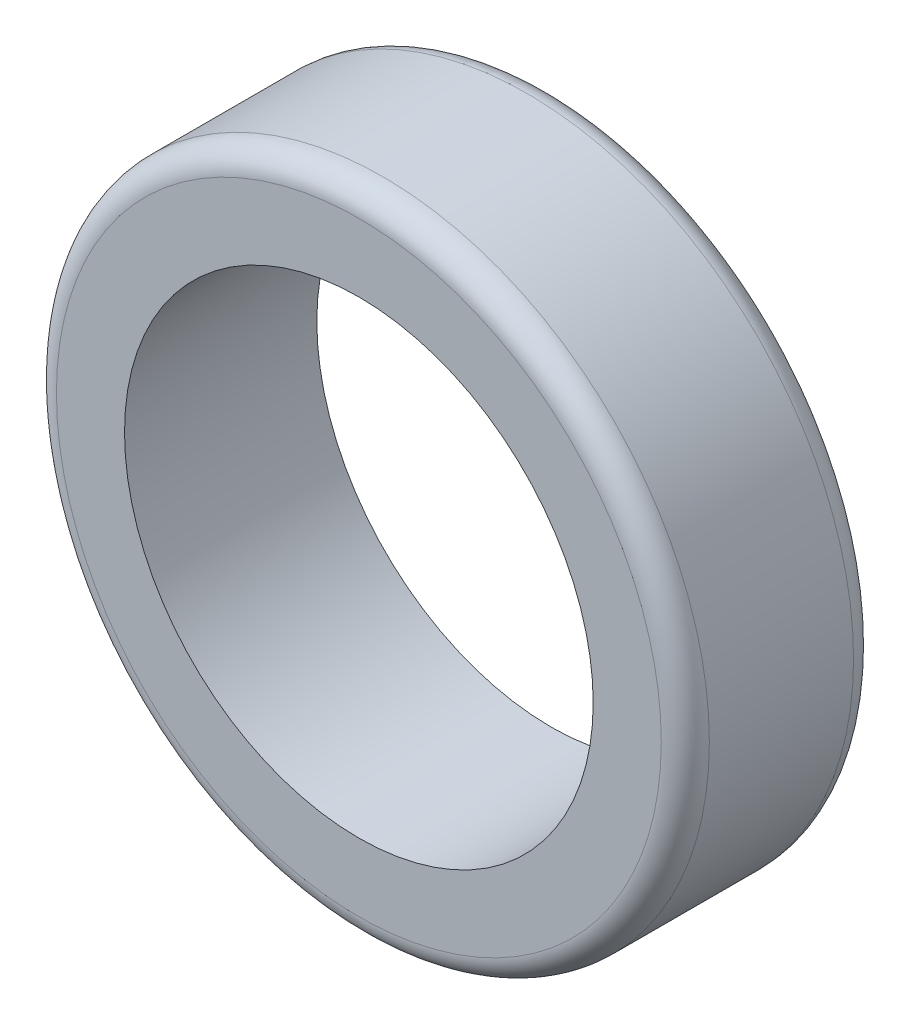
from build123d import *

# Parameters (mm, degrees)
SKETCH1_R           = 17.25
SKETCH1_R_2         = 12.3825
BOSS_EXTRUDE1_DEPTH = 10.16
FILLET1_R           = 1.27


with BuildPart() as part:
    # Sketch1 → Boss-Extrude1 (new body)
    with BuildSketch(Plane.XY):
        Circle(SKETCH1_R)
        Circle(SKETCH1_R_2, mode=Mode.SUBTRACT)
    extrude(amount=BOSS_EXTRUDE1_DEPTH)

    # Fillet1
    fillet1_edges = [part.edges().sort_by_distance(p)[0] for p in [
        (-17.25, 0, 0),
        (-17.25, 0, 10.16),
    ]]
    fillet(fillet1_edges, radius=FILLET1_R)


solid = part.part
